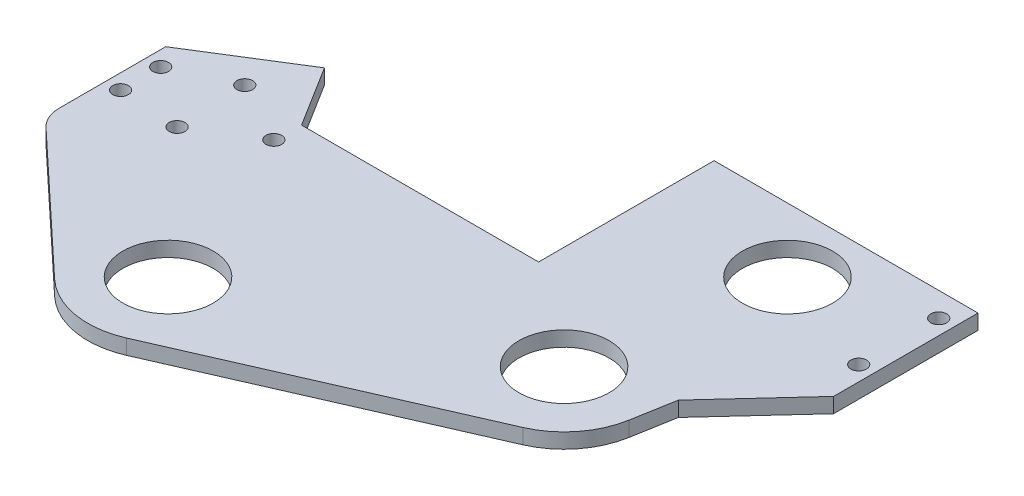
from build123d import *

# Parameters (mm, degrees)
SKETCH1_R              = 14.29004
BOSS_EXTRUDE1_DEPTH    = 4.7625
FILLET1_R              = 10
F_10_CLEARANCE_HOLE1_D = 4.9784
F_10_CLEARANCE_HOLE2_D = 4.9784


with BuildPart() as part:
    # Sketch1 → Boss-Extrude1 (new body)
    with BuildSketch(Plane(origin=(0, 0, 0), x_dir=(1, 0, 0), z_dir=(0, 1, 0))):
        with BuildLine():
            Line((-62.06952, -79.895280222), (25.163028109, -41.695780276))
            ThreePointArc((25.163028109, -41.695780276), (34.911191298, -34.148496119), (39.936134607, -22.890693115))
            Line((39.936134607, -22.890693115), (42.271095404, -9.586739751))
            Line((42.271095404, -9.586739751), (65.82695514, 16.012754812))
            Line((65.82695514, 16.012754812), (65.826833771, 61.726825209))
            Line((65.826833771, 61.726825209), (-17.734439664, 61.726825209))
            Line((-17.734439664, 61.726825209), (-17.734439664, 6.164245545))
            Line((-17.734439664, 6.164245545), (-92.776319002, 6.164245545))
            Line((-92.776319002, 6.164245545), (-104.854054452, 25.49254843))
            Line((-104.854054452, 25.49254843), (-135.785609254, 6.16425364))
            Line((-135.785609254, 6.16425364), (-135.785609254, -31.935712293))
            Line((-135.785609254, -31.935712293), (-89.620113812, -75.16814328))
            ThreePointArc((-89.620113812, -75.16814328), (-76.553580444, -81.662511553), (-62.06952, -79.895280222))
        make_face()
        with Locations(Location((25.821833771, 41.412625209, 0), (0, 0, 90))):
            Circle(SKETCH1_R, mode=Mode.SUBTRACT)
        with Locations(Location((15.012562201, -18.516537909, 0), (0, 0, 90))):
            Circle(SKETCH1_R, mode=Mode.SUBTRACT)
        with Locations(Location((-72.258332946, -56.628468385, 0), (0, 0, 90))):
            Circle(SKETCH1_R, mode=Mode.SUBTRACT)
    extrude(amount=BOSS_EXTRUDE1_DEPTH)

    # Fillet1
    fillet1_edges = [part.edges().sort_by_distance(p)[0] for p in [
        (-135.785609254, 2.38125, 31.935712293),
    ]]
    fillet(fillet1_edges, radius=FILLET1_R)

    # #10 Clearance Hole1 (through all)
    with Locations(Plane(origin=(0, 4.7625, 0), x_dir=(1, 0, 0), z_dir=(0, 1, 0))):
        with Locations((61.064354133, 54.057452946), (61.064421422, 28.712718776), (-131.023109254, -0.185754455), (-131.023109254, -12.885754455)):
            Hole(F_10_CLEARANCE_HOLE1_D / 2)

    # #10 Clearance Hole2 (through all)
    with Locations(Plane(origin=(0, 4.7625, 0), x_dir=(1, 0, 0), z_dir=(0, 1, 0))):
        with Locations((-111.967266406, -14.051352939), (-93.119428737, -2.273847251), (-112.732572492, 8.143472036)):
            Hole(F_10_CLEARANCE_HOLE2_D / 2)


solid = part.part
